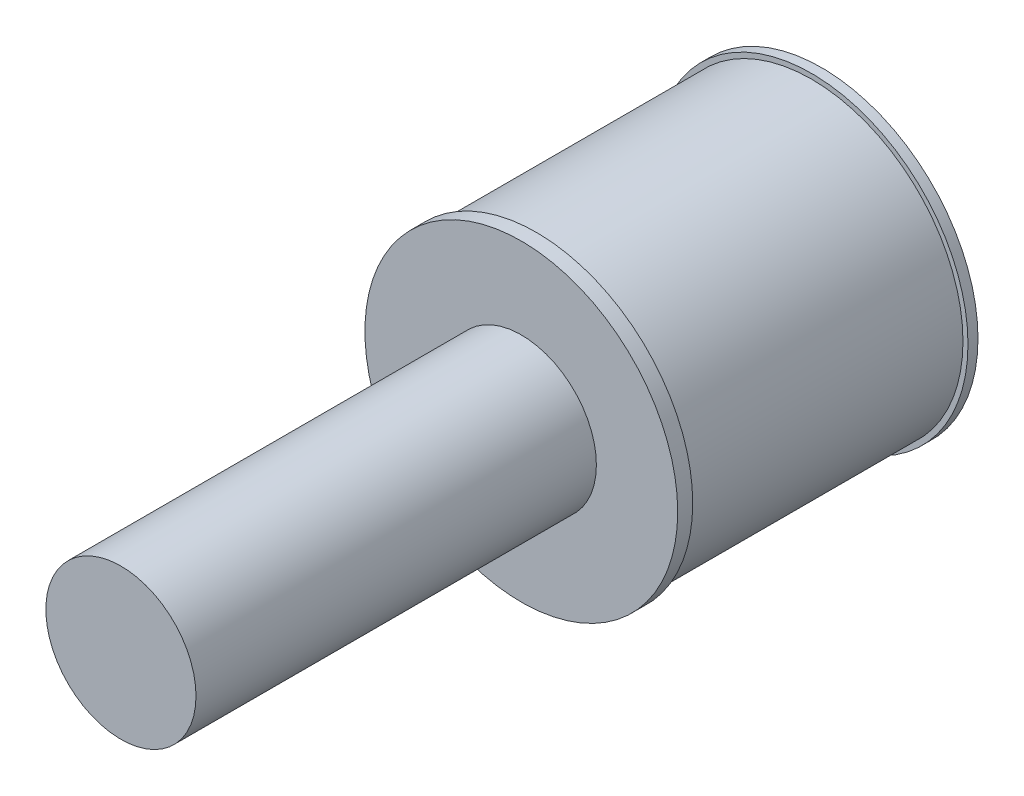
from build123d import *

# Parameters (mm, degrees)
S01_RETAINING_FLANGE_R                         = 6.25
F_01_RETAINING_FLANGE_DEPTH                    = 0.4
F_02_START                                     = 0.4
S02_INNER_RACE_AND_SEALED_ROLLING_ASSE_R       = 6.05
F_02_INNER_RACE_AND_SEALED_ROLLING_ASSEM_DEPTH = 11
F_03_START                                     = 11.4
S03_MOUNTING_THRUST_FACE_R                     = 6.25
F_03_MOUNTING_THRUST_FACE_DEPTH                = 0.6
F_04_START                                     = 12
S04_SIX_MILLIMETRE_STUD_WITH_FINAL_8_M_R       = 3
F_04_SIX_MILLIMETRE_STUD_WITH_FINAL_8_MM_DEPTH = 16
F_05_START                                     = -0.1
S05_ASSEMBLY_DRIVE_SLOT_W                      = 8.4
S05_ASSEMBLY_DRIVE_SLOT_H                      = 1.4
F_05_ASSEMBLY_DRIVE_SLOT_DEPTH                 = 0.7


with BuildPart() as part:
    # S01 - Retaining flange → 01 - Retaining flange (new body)
    with BuildSketch(Plane.XY):
        Circle(S01_RETAINING_FLANGE_R)
    extrude(amount=F_01_RETAINING_FLANGE_DEPTH)

    # S02 - Inner race and sealed rolling assembly envelope → 02 - Inner race and sealed rolling assembly envelope (add)
    with BuildSketch(Plane.XY.offset(F_02_START)):
        Circle(S02_INNER_RACE_AND_SEALED_ROLLING_ASSE_R)
    extrude(amount=F_02_INNER_RACE_AND_SEALED_ROLLING_ASSEM_DEPTH)

    # S03 - Mounting thrust face → 03 - Mounting thrust face (add)
    with BuildSketch(Plane.XY.offset(F_03_START)):
        Circle(S03_MOUNTING_THRUST_FACE_R)
    extrude(amount=F_03_MOUNTING_THRUST_FACE_DEPTH)

    # S04 - Six millimetre stud with final 8 mm M6 thread envelope → 04 - Six millimetre stud with final 8 mm M6 thread envelope (add)
    with BuildSketch(Plane.XY.offset(F_04_START)):
        Circle(S04_SIX_MILLIMETRE_STUD_WITH_FINAL_8_M_R)
    extrude(amount=F_04_SIX_MILLIMETRE_STUD_WITH_FINAL_8_MM_DEPTH)

    # S05 - Assembly drive slot → 05 - Assembly drive slot (cut)
    with BuildSketch(Plane.XY.offset(F_05_START)):
        Rectangle(S05_ASSEMBLY_DRIVE_SLOT_W, S05_ASSEMBLY_DRIVE_SLOT_H)
    extrude(amount=F_05_ASSEMBLY_DRIVE_SLOT_DEPTH, mode=Mode.SUBTRACT)


solid = part.part
